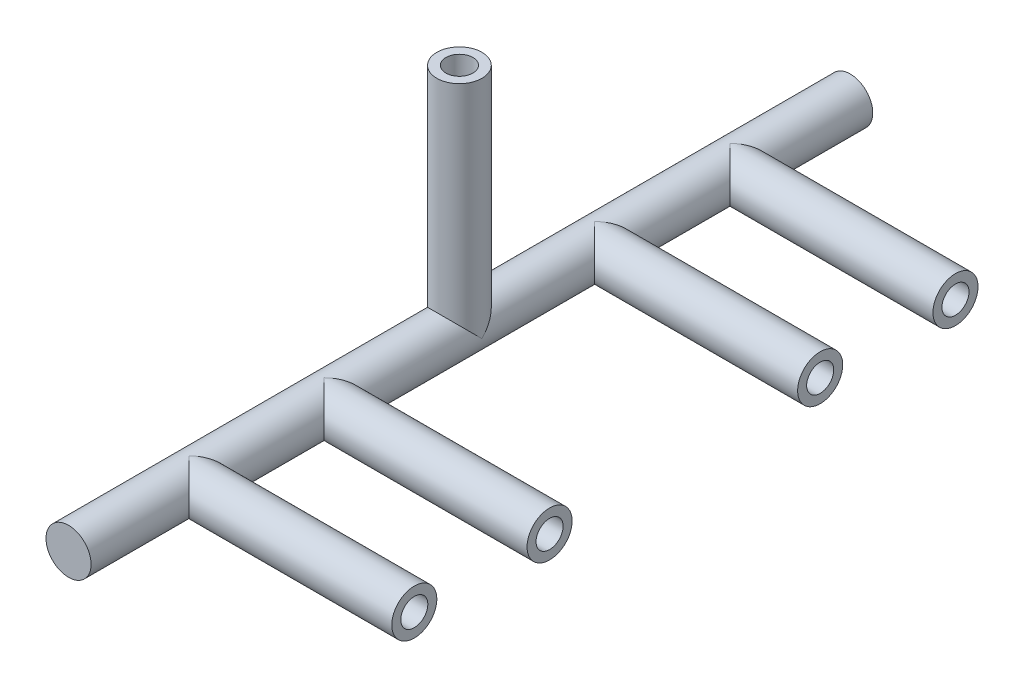
from build123d import *
from build123d.topology import SkipClean

# Parameters (mm, degrees)
SKETCH_1_R           = 7.5
SKETCH_1_R_2         = 4.5
EXTRUDE_1_DEPTH      = 125
EXTRUDE_2_REACH      = 151.958
EXTRUDE_2_END_RADIUS = 7.5
SKETCH_2_R           = 7.5
SKETCH_2_R_2         = 4.5
EXTRUDE_3_REACH      = 169.5
EXTRUDE_3_END_RADIUS = 7.5
SKETCH_3_R           = 7.5
SKETCH_3_R_2         = 4.5
SKETCH_4_R           = 7.5
EXTRUDE_4_DEPTH      = 5
EXTRUDE_START        = 5
SKETCH_5_R           = 7.5
EXTRUDE_5_DEPTH      = 5


with BuildPart() as part:
    # 草图1 → 凸台-拉伸1 (new, symmetric)
    with BuildSketch(Plane.XY):
        Circle(SKETCH_1_R)
        Circle(SKETCH_1_R_2, mode=Mode.SUBTRACT)
    extrude(amount=EXTRUDE_1_DEPTH, both=True)

    # 凸台-拉伸2: up to this cylinder (the profile starts outside it)
    extrude_2_end = Plane(origin=(0, 0, -7.287868), z_dir=(0, 0, -1)) * Cylinder(EXTRUDE_2_END_RADIUS, 319.916, mode=Mode.PRIVATE)
    # 草图2 → 凸台-拉伸2 (add, up to the surface)
    with BuildSketch(Plane(origin=(0, 75, 0), x_dir=(1, 0, 0), z_dir=(0, 1, 0)), mode=Mode.PRIVATE) as extrude_2_sk1:
        with Locations(Location((0, 0, 0), (0, 0, 270))):
            Circle(SKETCH_2_R)
        with Locations(Location((0, 0, 0), (0, 0, 270))):
            Circle(SKETCH_2_R_2, mode=Mode.SUBTRACT)
    extrude_2_tool1 = extrude(extrude_2_sk1.sketch, amount=-EXTRUDE_2_REACH, mode=Mode.PRIVATE) - extrude_2_end
    add(extrude_2_tool1.solids().sort_by_distance((0, 75, -7.287868))[0])

    # 凸台-拉伸3: up to this cylinder (the profile starts outside it)
    extrude_3_end = Plane(origin=(0, 0, 0), z_dir=(0, 0, -1)) * Cylinder(EXTRUDE_3_END_RADIUS, 549.575736, mode=Mode.PRIVATE)
    # 草图3 → 凸台-拉伸3 (add, up to the surface)
    with BuildSketch(Plane(origin=(75, 0, 0), x_dir=(0, 0, -1), z_dir=(1, 0, 0)), mode=Mode.PRIVATE) as extrude_3_sk1:
        with Locations((-45, 0)):
            Circle(SKETCH_3_R)
        with Locations((-45, 0)):
            Circle(SKETCH_3_R_2, mode=Mode.SUBTRACT)
    extrude_3_tool1 = extrude(extrude_3_sk1.sketch, amount=-EXTRUDE_3_REACH, mode=Mode.PRIVATE) - extrude_3_end
    add(extrude_3_tool1.solids().sort_by_distance((75, 0, 52.287868))[0])
    # 草图3 → 凸台-拉伸3 (add, up to the surface)
    with BuildSketch(Plane(origin=(75, 0, 0), x_dir=(0, 0, -1), z_dir=(1, 0, 0)), mode=Mode.PRIVATE) as extrude_3_sk2:
        with Locations((-90, 0)):
            Circle(SKETCH_3_R)
        with Locations((-90, 0)):
            Circle(SKETCH_3_R_2, mode=Mode.SUBTRACT)
    extrude_3_tool2 = extrude(extrude_3_sk2.sketch, amount=-EXTRUDE_3_REACH, mode=Mode.PRIVATE) - extrude_3_end
    add(extrude_3_tool2.solids().sort_by_distance((75, 0, 97.287868))[0])
    # 草图3 → 凸台-拉伸3 (add, up to the surface)
    with BuildSketch(Plane(origin=(75, 0, 0), x_dir=(0, 0, -1), z_dir=(1, 0, 0)), mode=Mode.PRIVATE) as extrude_3_sk3:
        with Locations(Location((90, 0, 0), (0, 0, 180))):
            Circle(SKETCH_3_R)
        with Locations((90, 0)):
            Circle(SKETCH_3_R_2, mode=Mode.SUBTRACT)
    extrude_3_tool3 = extrude(extrude_3_sk3.sketch, amount=-EXTRUDE_3_REACH, mode=Mode.PRIVATE) - extrude_3_end
    add(extrude_3_tool3.solids().sort_by_distance((75, 0, -97.287868))[0])
    # 草图3 → 凸台-拉伸3 (add, up to the surface)
    with BuildSketch(Plane(origin=(75, 0, 0), x_dir=(0, 0, -1), z_dir=(1, 0, 0)), mode=Mode.PRIVATE) as extrude_3_sk4:
        with Locations(Location((45, 0, 0), (0, 0, 180))):
            Circle(SKETCH_3_R)
        with Locations((45, 0)):
            Circle(SKETCH_3_R_2, mode=Mode.SUBTRACT)
    extrude_3_tool4 = extrude(extrude_3_sk4.sketch, amount=-EXTRUDE_3_REACH, mode=Mode.PRIVATE) - extrude_3_end
    add(extrude_3_tool4.solids().sort_by_distance((75, 0, -52.287868))[0])

    # 草图4 → 凸台-拉伸4 (add)
    with SkipClean():  # the faces are left unmerged after this step: merging them gives an invalid solid
        with BuildSketch(Plane(origin=(0, 0, -125), x_dir=(-1, 0, 0), z_dir=(0, 0, -1))):
            Circle(SKETCH_4_R)
        extrude(amount=EXTRUDE_4_DEPTH)

    # 草图5 → 凸台-拉伸5 (add)
    with SkipClean():  # the faces are left unmerged after this step: merging them gives an invalid solid
        with BuildSketch(Plane.XY.offset(125).offset(EXTRUDE_START)):
            with Locations(Location((0, 0, 0), (0, 0, 180))):
                Circle(SKETCH_5_R)
        extrude(amount=-EXTRUDE_5_DEPTH)


solid = part.part
